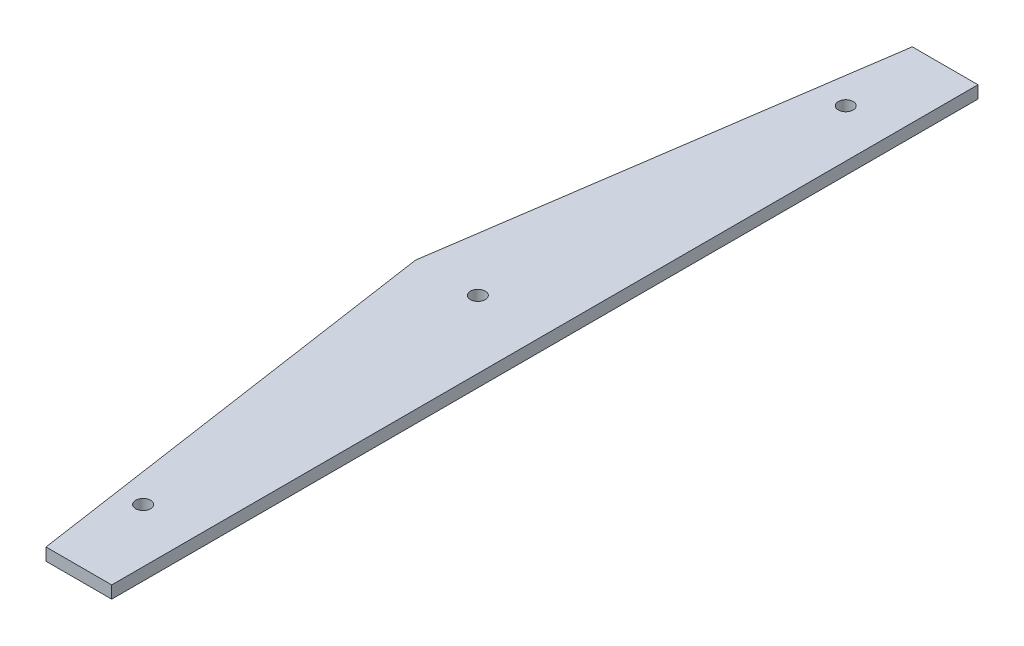
from build123d import *

# Parameters (mm, degrees)
SKETCH1_R      = 1.89865
MAINBODY_DEPTH = 3.175


with BuildPart() as part:
    # Sketch1 → MainBody (new body)
    with BuildSketch(Plane(origin=(0, 7.659460084, 0), x_dir=(1, 0, 0), z_dir=(0, 1, 0))):
        Polygon((-141.5163305, 104.251042847), (-124.67137867, 104.251042847), (-124.67137867, -117.799669373), (-141.5163305, -117.799669373), (-157.82954988, -6.774313263), align=None)
        with Locations(Location((-136.956490805, 82.636522264, 0), (0, 0, 270))):
            Circle(SKETCH1_R, mode=Mode.SUBTRACT)
        with Locations(Location((-142.016337919, -6.608646442, 0), (0, 0, 270))):
            Circle(SKETCH1_R, mode=Mode.SUBTRACT)
        with Locations(Location((-138.493225998, -95.927680655, 0), (0, 0, 270))):
            Circle(SKETCH1_R, mode=Mode.SUBTRACT)
    extrude(amount=-MAINBODY_DEPTH)


solid = part.part
